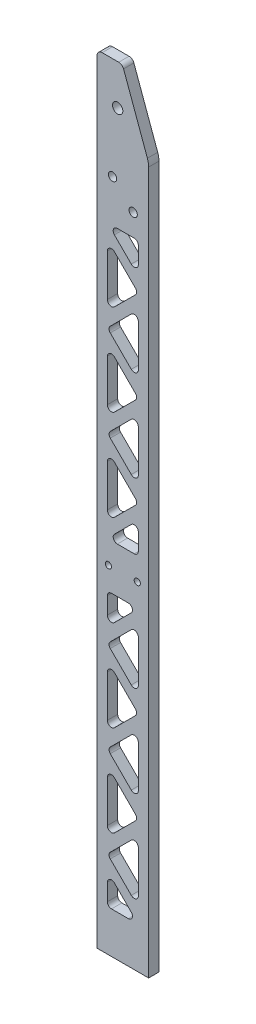
from build123d import *

# Parameters (mm, degrees)
ESQUISSE1_W                  = 50
ESQUISSE1_H                  = 594
BOSS_EXTRU_1_DEPTH           = 10
ENL_V_MAT_EXTRU_1_DEPTH      = 597.18453519
ENL_V_MAT_EXTRU_1_DEPTH_BACK = 597.18453519
CONG_1_R                     = 4
ESQUISSE3_W                  = 50
ESQUISSE3_H                  = 30
BOSS_EXTRU_2_DEPTH           = 10
ENL_V_MAT_EXTRU_2_DEPTH      = 597.18453519
ENL_V_MAT_EXTRU_2_DEPTH_BACK = 597.18453519
ESQUISSE4_R                  = 3
BOSS_EXTRU_3_DEPTH           = 10
ENL_V_MAT_EXTRU_3_DEPTH      = 726.793359022
ENL_V_MAT_EXTRU_3_DEPTH_BACK = 726.793359022
ESQUISSE6_R                  = 4
ESQUISSE6_R_2                = 5
CONG_2_R                     = 5
CONG_3_R                     = 20


with BuildPart() as part:
    # Esquisse1 → Boss.-Extru.1 (new body)
    with BuildSketch(Plane.XY):
        with Locations((25, 297)):
            Rectangle(ESQUISSE1_W, ESQUISSE1_H)
    extrude(amount=BOSS_EXTRU_1_DEPTH)

    # Esquisse2 → Enlèv. mat.-Extru.1 (cut, two sides: drawn at the far end of the back side and taken through both)
    with BuildSketch(Plane.XY.offset(10).offset(-ENL_V_MAT_EXTRU_1_DEPTH_BACK)):
        Polygon((10, 10), (40, 10), (10, 40), align=None)
        Polygon((40, 24.142135624), (10, 54.142135624), (40, 84.142135624), align=None)
        Polygon((10, 68.284271247), (10, 128.284271247), (40, 98.284271247), align=None)
        Polygon((40, 172.426406871), (10, 142.426406871), (40, 112.426406871), align=None)
        Polygon((10, 156.568542495), (10, 216.568542495), (40, 186.568542495), align=None)
        Polygon((40, 260.710678119), (10, 230.710678119), (40, 200.710678119), align=None)
        Polygon((40, 274.852813742), (10, 244.852813742), (10, 274.852813742), align=None)
        Polygon((40, 348.994949366), (10, 318.994949366), (40, 318.994949366), align=None)
        Polygon((10, 333.13708499), (10, 393.13708499), (40, 363.13708499), align=None)
        Polygon((40, 437.279220614), (10, 407.279220614), (40, 377.279220614), align=None)
        Polygon((10, 421.421356237), (10, 481.421356237), (40, 451.421356237), align=None)
        Polygon((40, 525.563491861), (10, 495.563491861), (40, 465.563491861), align=None)
        Polygon((10, 509.705627485), (10, 569.705627485), (40, 539.705627485), align=None)
        Polygon((10, 583.847763109), (40, 553.847763109), (40, 583.847763109), align=None)
    extrude(amount=ENL_V_MAT_EXTRU_1_DEPTH + ENL_V_MAT_EXTRU_1_DEPTH_BACK, mode=Mode.SUBTRACT)

    # Congé1
    cong_1_edges = [part.edges().sort_by_distance(p)[0] for p in [
        (40, 112.426406871, 5),
        (10, 142.426406871, 5),
        (40, 172.426406871, 5),
        (40, 539.705627485, 5),
        (10, 509.705627485, 5),
        (10, 569.705627485, 5),
        (40, 377.279220614, 5),
        (10, 407.279220614, 5),
        (40, 437.279220614, 5),
        (40, 363.13708499, 5),
        (10, 333.13708499, 5),
        (10, 393.13708499, 5),
        (40, 465.563491861, 5),
        (10, 495.563491861, 5),
        (40, 525.563491861, 5),
        (40, 451.421356237, 5),
        (10, 421.421356237, 5),
        (10, 481.421356237, 5),
        (10, 10, 5),
        (10, 40, 5),
        (40, 10, 5),
        (40, 200.710678119, 5),
        (10, 230.710678119, 5),
        (40, 260.710678119, 5),
        (40, 186.568542495, 5),
        (10, 156.568542495, 5),
        (10, 216.568542495, 5),
        (10, 244.852813742, 5),
        (10, 274.852813742, 5),
        (40, 274.852813742, 5),
        (40, 318.994949366, 5),
        (10, 318.994949366, 5),
        (40, 348.994949366, 5),
        (40, 98.284271247, 5),
        (10, 68.284271247, 5),
        (10, 128.284271247, 5),
        (40, 84.142135624, 5),
        (40, 24.142135624, 5),
        (10, 54.142135624, 5),
        (10, 583.847763109, 5),
        (40, 583.847763109, 5),
        (40, 553.847763109, 5),
    ]]
    fillet(cong_1_edges, radius=CONG_1_R)

    # Esquisse3 → Boss.-Extru.2 (add)
    with BuildSketch(Plane.XY.offset(10)):
        with Locations((25, -15)):
            Rectangle(ESQUISSE3_W, ESQUISSE3_H)
    extrude(amount=-BOSS_EXTRU_2_DEPTH)

    # Esquisse4 → Enlèv. mat.-Extru.2 (cut, two sides: drawn at the far end of the back side and taken through both)
    with BuildSketch(Plane.XY.offset(10).offset(-ENL_V_MAT_EXTRU_2_DEPTH_BACK)):
        with Locations((39, 296.923881554)):
            Circle(ESQUISSE4_R)
        with Locations(Location((11, 296.923881554, 0), (0, 0, 180))):
            Circle(ESQUISSE4_R)
    extrude(amount=ENL_V_MAT_EXTRU_2_DEPTH + ENL_V_MAT_EXTRU_2_DEPTH_BACK, mode=Mode.SUBTRACT)

    # Esquisse5 → Boss.-Extru.3 (add)
    with BuildSketch(Plane.XY.offset(10)):
        Polygon((50, 594), (0, 594), (0, 724), (24.522083601, 724), (50, 654), align=None)
    extrude(amount=-BOSS_EXTRU_3_DEPTH)

    # Esquisse6 → Enlèv. mat.-Extru.3 (cut, two sides: drawn at the far end of the back side and taken through both)
    with BuildSketch(Plane(origin=(0, 0, 0), x_dir=(-1, 0, 0), z_dir=(0, 0, -1)).offset(-ENL_V_MAT_EXTRU_3_DEPTH_BACK)):
        with Locations((-15, 625)):
            Circle(ESQUISSE6_R)
        with Locations((-35, 605)):
            Circle(ESQUISSE6_R)
        with Locations((-20, 685)):
            Circle(ESQUISSE6_R_2)
    extrude(amount=ENL_V_MAT_EXTRU_3_DEPTH + ENL_V_MAT_EXTRU_3_DEPTH_BACK, mode=Mode.SUBTRACT)

    # Congé2
    cong_2_edges = [part.edges().sort_by_distance(p)[0] for p in [
        (0, 724, 5),
        (24.522083601, 724, 5),
    ]]
    fillet(cong_2_edges, radius=CONG_2_R)

    # Congé3
    cong_3_edges = [part.edges().sort_by_distance(p)[0] for p in [
        (50, 654, 5),
    ]]
    fillet(cong_3_edges, radius=CONG_3_R)


solid = part.part
